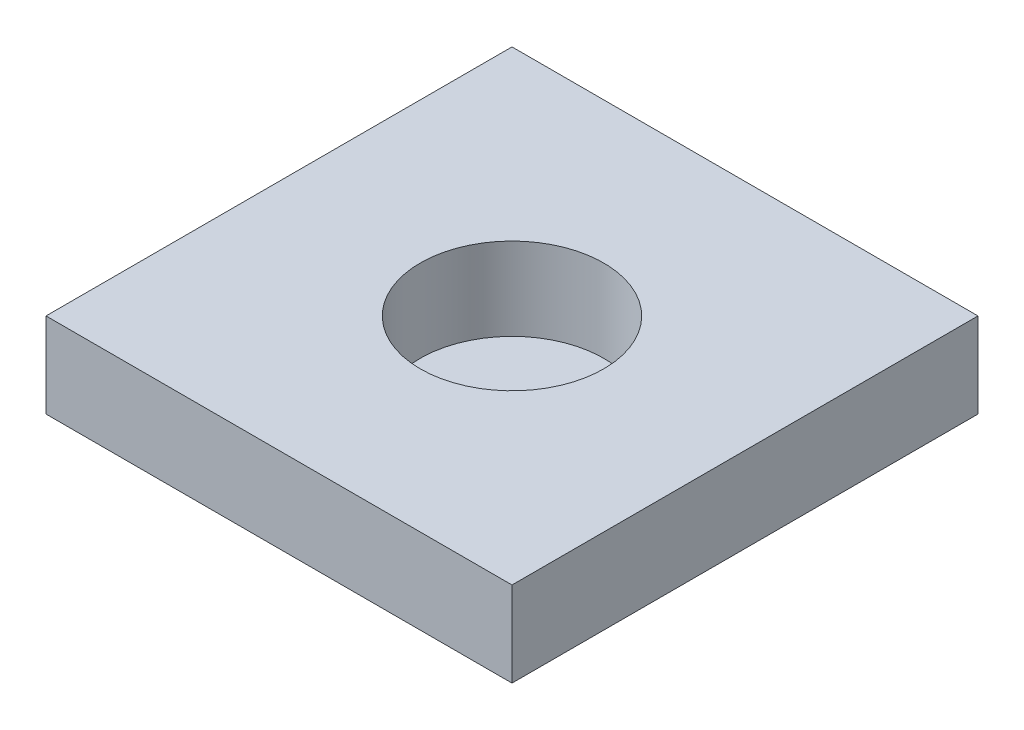
from build123d import *

# Parameters (mm, degrees)
SKETCH1_W           = 152.4
SKETCH1_H           = 152.4
BOSS_EXTRUDE1_DEPTH = 0.8
SKETCH2_R           = 5.25
CUT_EXTRUDE2_DEPTH  = 254
SKETCH3_W           = 152.4
SKETCH3_H           = 152.4
BOSS_EXTRUDE2_DEPTH = 27
SKETCH4_R           = 30
CUT_EXTRUDE3_DEPTH  = 27


with BuildPart() as part:
    # Sketch1 → Boss-Extrude1 (new body)
    with BuildSketch(Plane(origin=(0, 0, 0), x_dir=(1, 0, 0), z_dir=(0, 1, 0))):
        with Locations((76.2, 76.2)):
            Rectangle(SKETCH1_W, SKETCH1_H)
    extrude(amount=BOSS_EXTRUDE1_DEPTH)

    # Sketch2 → Cut-Extrude2 (cut)
    with BuildSketch(Plane(origin=(0, 0.8, 0), x_dir=(1, 0, 0), z_dir=(0, 1, 0))):
        with Locations(Location((76.2, 76.2, 0), (0, 0, 270))):
            Circle(SKETCH2_R)
    extrude(amount=-CUT_EXTRUDE2_DEPTH, mode=Mode.SUBTRACT)

    # Sketch3 → Boss-Extrude2 (add)
    with BuildSketch(Plane(origin=(0, 0.8, 0), x_dir=(1, 0, 0), z_dir=(0, 1, 0))):
        with Locations((76.2, 76.2)):
            Rectangle(SKETCH3_W, SKETCH3_H)
    extrude(amount=BOSS_EXTRUDE2_DEPTH)

    # Sketch4 → Cut-Extrude3 (cut)
    with BuildSketch(Plane(origin=(0, 27.8, 0), x_dir=(1, 0, 0), z_dir=(0, 1, 0))):
        with Locations(Location((76.2, 76.2, 0), (0, 0, 270))):
            Circle(SKETCH4_R)
    extrude(amount=-CUT_EXTRUDE3_DEPTH, mode=Mode.SUBTRACT)


solid = part.part
